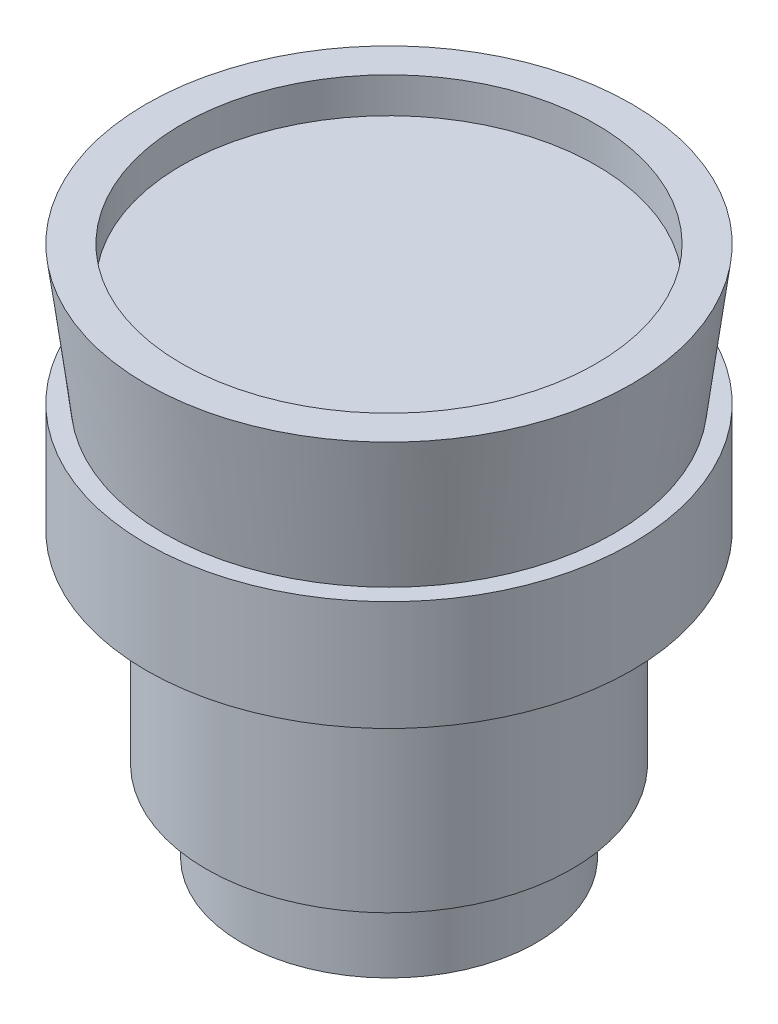
from build123d import *

# Parameters (mm, degrees)
SKETCH2_R          = 14.859
CUT_EXTRUDE1_DEPTH = 2.54


with BuildPart() as part:
    # Sketch1 → Revolve1 (revolve)
    with BuildSketch(Plane(origin=(0, 0, 0), x_dir=(0, 0, -1), z_dir=(1, 0, 0))):
        Polygon((0, 17.78), (-17.399, 17.78), (-16.129, 7.874), (-17.399, 7.874), (-17.399, 0), (-13.1064, 0), (-13.1064, -14.478), (-10.5664, -14.478), (-10.5664, -20.32), (0, -20.32), align=None)
    revolve(axis=Axis((0, 17.78, 0), (0, -1, 0)))

    # Sketch2 → Cut-Extrude1 (cut)
    with BuildSketch(Plane(origin=(0, 17.78, 0), x_dir=(1, 0, 0), z_dir=(0, 1, 0))):
        with Locations(Location((0, 0, 0), (0, 0, 270))):
            Circle(SKETCH2_R)
    extrude(amount=-CUT_EXTRUDE1_DEPTH, mode=Mode.SUBTRACT)


solid = part.part
